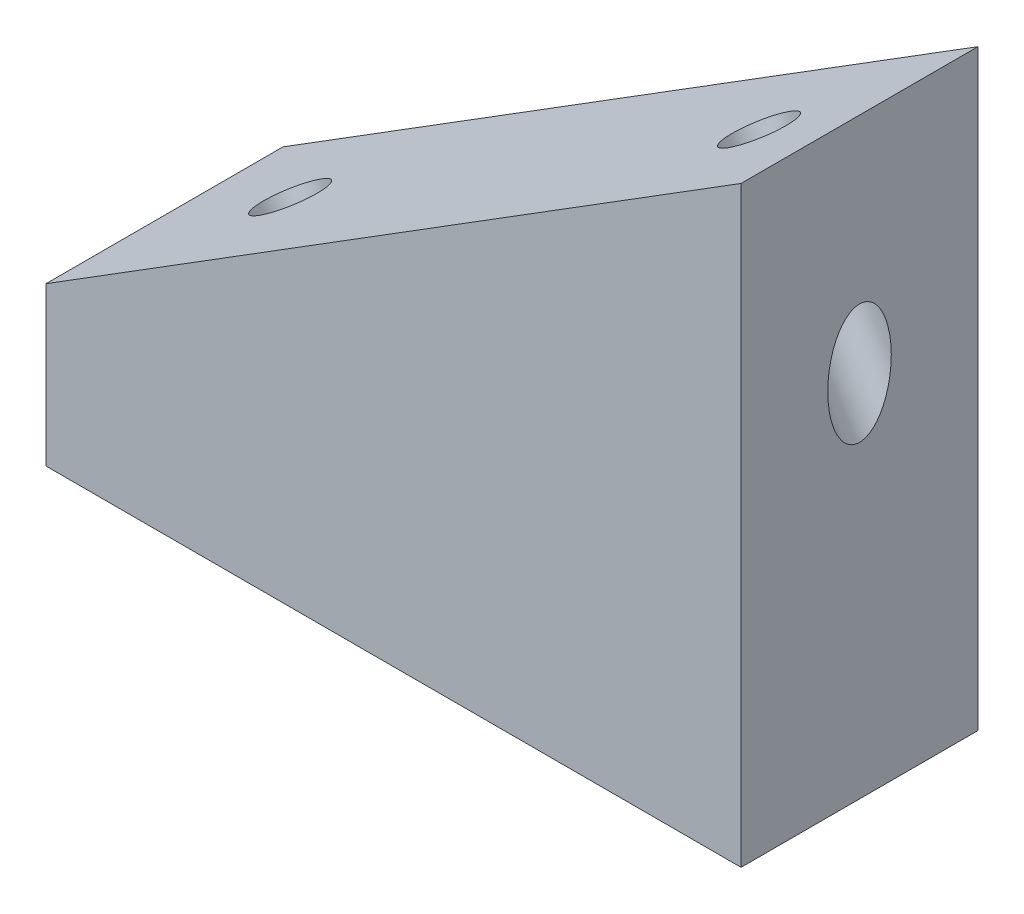
from build123d import *

# Parameters (mm, degrees)
BOSS_EXTRUDE1_DEPTH            = 19.05
F_7_0_201_DIAMETER_HOLE1_D     = 5.1054
F_7_0_201_DIAMETER_HOLE1_DEPTH = 25.4


with BuildPart() as part:
    # Sketch2 → Boss-Extrude1 (new body)
    with BuildSketch(Plane.XY):
        Polygon((0, 47.617699385), (-55.88, 12.7), (-55.88, 0), (0, 0), align=None)
    extrude(amount=BOSS_EXTRUDE1_DEPTH)

    # #7 (0.201) Diameter Hole1
    with Locations(Plane(origin=(-21.399252353, 34.245962436, 0), x_dir=(0.8480480961564308, 0.5299192642331972, 0), z_dir=(-0.5299192642331972, 0.848048096156431, 0))):
        with Locations((-28.741463778, -9.525), (15.708536222, -9.525)):
            Hole(F_7_0_201_DIAMETER_HOLE1_D / 2, depth=F_7_0_201_DIAMETER_HOLE1_DEPTH)


solid = part.part
